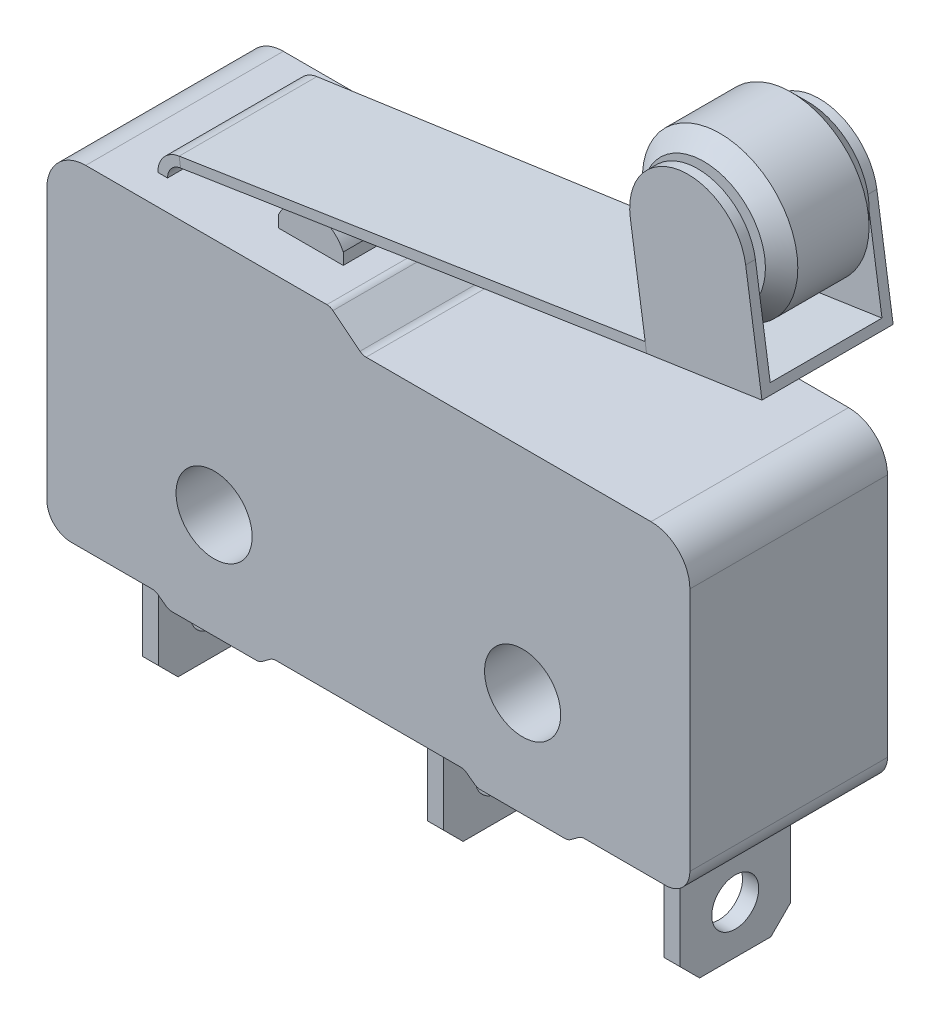
from build123d import *

# Parameters (mm, degrees)
SKETCH_2_R          = 1.175
EXTRUDE_1_DEPTH     = 3.05
SKETCH_3_W          = 0.500000082
SKETCH_3_H          = 3.90000036
SKETCH_3_W_2        = 0.500000024
SKETCH_3_W_3        = 0.499999151
EXTRUDE_2_DEPTH     = 1.7
CHAMFER_1_SIZE      = 0.6
SKETCH_4_R          = 0.725
CUT_EXTRUDE_1_DEPTH = 20.868288851
EXTRUDE_3_DEPTH     = 2.125
CUT_EXTRUDE_START   = -0.3
CUT_EXTRUDE_2_DEPTH = 0.3
EXTRUDE_4_DEPTH     = 0.3
EXTRUDE_5_DEPTH     = 1.75


with BuildPart() as part:
    # 草图2 → 凸台-拉伸1 (new, symmetric)
    with BuildSketch(Plane.XY):
        with BuildLine():
            Line((13.487499724, 6.562500338), (4.69273426, 6.562500338))
            ThreePointArc((4.69273426, 6.562500338), (4.593432177, 6.579411842), (4.505325746, 6.628239695))
            Line((4.505325746, 6.628239695), (3.669674138, 7.296760981))
            ThreePointArc((3.669674138, 7.296760981), (3.581567707, 7.345588834), (3.482265624, 7.362500338))
            Line((3.482265624, 7.362500338), (-3.962500435, 7.362500338))
            ThreePointArc((-3.962500435, 7.362500338), (-4.811028502, 7.011028231), (-5.162500208, 6.162499997))
            Line((-5.162500208, 6.162499997), (-5.162500208, -2.187499788))
            ThreePointArc((-5.162500208, -2.187499788), (-4.942830121, -2.717830133), (-4.412499671, -2.937499962))
            Line((-4.412499671, -2.937499962), (-1.910055005, -2.937499962))
            ThreePointArc((-1.910055005, -2.937499962), (-1.860600884, -2.941604254), (-1.812499919, -2.953804763))
            ThreePointArc((-1.812499919, -2.953804763), (-1.771521076, -2.971401684), (-1.73360371, -2.994879131))
            Line((-1.73360371, -2.994879131), (-1.47889644, -3.180120782))
            ThreePointArc((-1.47889644, -3.180120782), (-1.395218116, -3.222794781), (-1.302444791, -3.237499962))
            Line((-1.302444791, -3.237499962), (1.302444797, -3.237499962))
            ThreePointArc((1.302444797, -3.237499962), (1.395218044, -3.222794752), (1.478896294, -3.180120768))
            Line((1.478896294, -3.180120768), (1.733603576, -2.994879137))
            ThreePointArc((1.733603576, -2.994879137), (1.771521006, -2.971401677), (1.812499919, -2.953804763))
            ThreePointArc((1.812499919, -2.953804763), (1.860600869, -2.9416043), (1.910054967, -2.937500048))
            Line((1.910054967, -2.937500048), (7.61494474, -2.937500048))
            ThreePointArc((7.61494474, -2.937500048), (7.664398838, -2.941604317), (7.712499786, -2.953804797))
            ThreePointArc((7.712499786, -2.953804797), (7.753478741, -2.97140175), (7.791396204, -2.994879262))
            Line((7.791396204, -2.994879262), (8.046103615, -3.180120719))
            ThreePointArc((8.046103615, -3.180120719), (8.129781833, -3.222794684), (8.222555042, -3.237499892))
            Line((8.222555042, -3.237499892), (10.827444745, -3.237499892))
            ThreePointArc((10.827444745, -3.237499892), (10.920217939, -3.22279471), (11.003896153, -3.18012078))
            Line((11.003896153, -3.18012078), (11.25860355, -2.994879149))
            ThreePointArc((11.25860355, -2.994879149), (11.296520992, -2.971401705), (11.337499914, -2.953804809))
            ThreePointArc((11.337499914, -2.953804809), (11.385600857, -2.94160437), (11.435054945, -2.937500139))
            Line((11.435054945, -2.937500139), (13.93749961, -2.937500139))
            ThreePointArc((13.93749961, -2.937500139), (14.467829886, -2.717830091), (14.687499579, -2.187499669))
            Line((14.687499579, -2.187499669), (14.687499973, 5.362500307))
            ThreePointArc((14.687499973, 5.362500307), (14.336028024, 6.211028543), (13.487499724, 6.562500338))
        make_face()
        Circle(SKETCH_2_R, mode=Mode.SUBTRACT)
        with Locations((9.524999919, 0)):
            Circle(SKETCH_2_R, mode=Mode.SUBTRACT)
    extrude(amount=EXTRUDE_1_DEPTH, both=True)

    # 草图3 → 凸台-拉伸2 (add, symmetric)
    with BuildSketch(Plane.XY):
        with Locations((-3.312500165, -4.887500279)):
            Rectangle(SKETCH_3_W, SKETCH_3_H)
        with Locations((5.487499933, -4.887500279)):
            Rectangle(SKETCH_3_W_2, SKETCH_3_H)
        with Locations((12.787499959, -4.887500279)):
            Rectangle(SKETCH_3_W_3, SKETCH_3_H)
    extrude(amount=EXTRUDE_2_DEPTH, both=True)

    # 倒角1
    chamfer_1_edges = [part.edges().sort_by_distance(p)[0] for p in [
        (5.487499933, -6.837500459, -1.7),
        (5.487499933, -6.837500459, 1.7),
        (12.787499959, -6.837500459, -1.7),
        (12.787499959, -6.837500459, 1.7),
        (-3.312500165, -6.837500459, -1.7),
        (-3.312500165, -6.837500459, 1.7),
    ]]
    chamfer(chamfer_1_edges, length=CHAMFER_1_SIZE)

    # 草图4 → 切除-拉伸1 (cut, through all)
    with BuildSketch(Plane(origin=(13.037499535, 0, 0), x_dir=(0, 0, -1), z_dir=(1, 0, 0))):
        with Locations((0, -5.357500459)):
            Circle(SKETCH_4_R)
    extrude(amount=-CUT_EXTRUDE_1_DEPTH, mode=Mode.SUBTRACT)

    # 草图5 → 凸台-拉伸3 (add, symmetric)
    with BuildSketch(Plane.XY):
        with BuildLine():
            Line((-2.00288027, 8.128026474), (15.843157285, 10.795134123))
            Line((15.843157285, 10.795134123), (15.887499977, 10.498430316))
            Line((15.887499977, 10.498430316), (-1.958537352, 7.83132183))
            ThreePointArc((-1.958537352, 7.83132183), (-2.247579011, 7.671926839), (-2.36250018, 7.3625))
            Line((-2.36250018, 7.3625), (-2.662500081, 7.3625))
            ThreePointArc((-2.662500081, 7.3625), (-2.474848467, 7.867754658), (-2.00288027, 8.128026474))
        make_face()
    extrude(amount=EXTRUDE_3_DEPTH, both=True)

    # 草图6 → 切除-拉伸2 (cut)
    with BuildSketch(Plane(origin=(-1.231960405, 8.243241197, 0), x_dir=(0.9890158676886913, 0.14780938217848383, 0), z_dir=(-0.1478093821784838, 0.9890158676886912, 0)).offset(CUT_EXTRUDE_START)):
        Polygon((17.264756054, 2.025), (13.664756054, 2.025), (-0.779481797, 2.125), (17.264756054, 2.125), align=None)
        Polygon((13.664756054, -2.025), (17.264756054, -2.025), (17.264756054, -2.125), (-0.779481797, -2.125), align=None)
    extrude(amount=CUT_EXTRUDE_2_DEPTH, mode=Mode.SUBTRACT)

    # 草图7 → 凸台-拉伸4 (add)
    with BuildSketch(Plane.XY.offset(2.025)):
        with BuildLine():
            Line((15.384947921, 13.861083805), (15.887500281, 10.498429449))
            Line((15.887500281, 10.498429449), (12.327042625, 9.966315937))
            Line((12.327042625, 9.966315937), (11.824490813, 13.328969925))
            ThreePointArc((11.824490813, 13.328969925), (13.338662427, 15.375255419), (15.384947921, 13.861083805))
        make_face()
    extrude_4 = extrude(amount=-EXTRUDE_4_DEPTH)

    # 镜向2: 凸台-拉伸4 across plane
    add(extrude_4.mirror(Plane.XY))

    # 草图9 → 凸台-拉伸5 (add, symmetric)
    with BuildSketch(Plane.XY):
        with BuildLine():
            Line((2.687499919, 7.720757525), (2.687499919, 7.362500054))
            Line((2.687499919, 7.362500054), (0.687500025, 7.362500099))
            Line((0.687500025, 7.362500099), (0.687500025, 7.720757542))
            ThreePointArc((0.687500025, 7.720757542), (1.687499978, 8.362499924), (2.687499919, 7.720757525))
        make_face()
    extrude(amount=EXTRUDE_5_DEPTH, both=True)


with BuildPart() as body_2:
    # 草图8 → 旋转1 (revolve)
    with BuildSketch(Plane(origin=(-1.69016956, 11.309190857, 0), x_dir=(0.9890158676886913, 0.14780938217848383, 0), z_dir=(-0.1478093821784838, 0.9890158676886912, 0)), mode=Mode.PRIVATE) as revolve_1_sk:
        Polygon((15.464755851, 1.665), (15.464755851, -1.535), (13.564755851, -1.535), (13.064755851, -1.035), (13.064755851, 1.165), (13.564755851, 1.665), align=None)
    revolve(revolve_1_sk.sketch.rotate(Axis((13.604719367, 13.595026865, -1.725), (0, 0, -1)), 188.499998323), axis=Axis((13.604719367, 13.595026865, -1.725), (0, 0, -1)))


solid = Compound([part.part, body_2.part])
